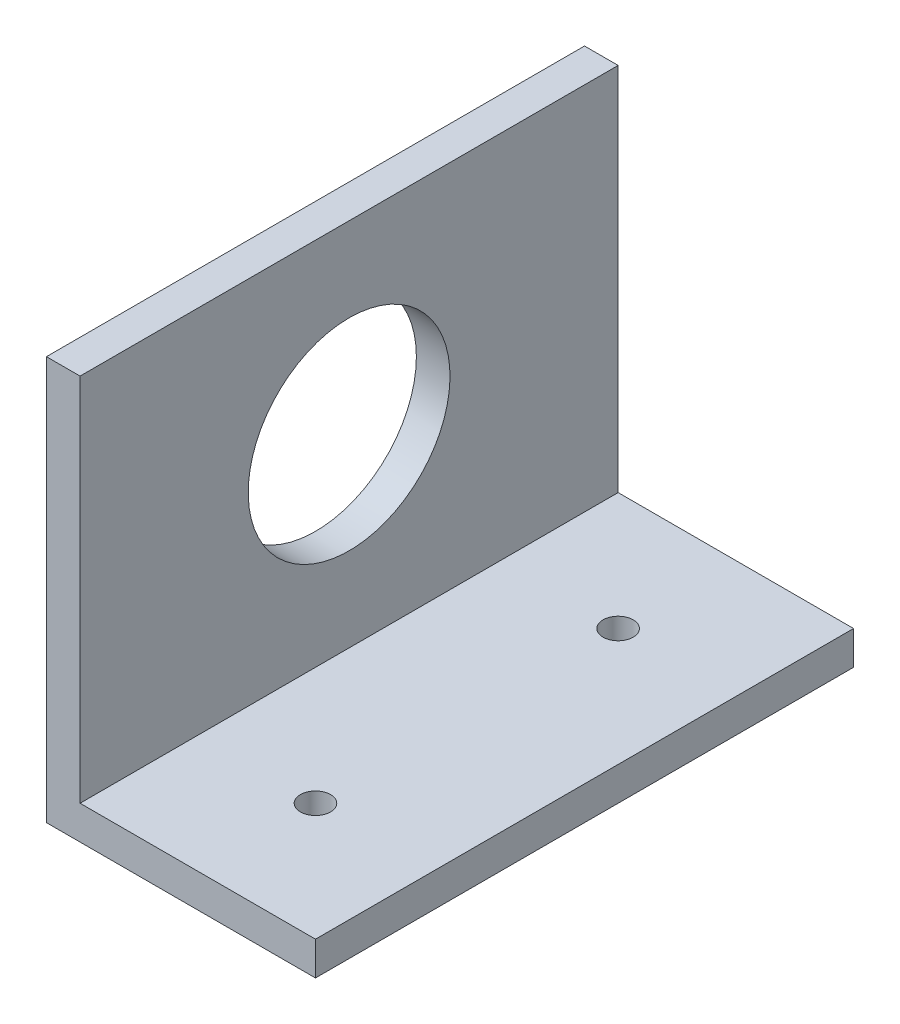
from build123d import *

# Parameters (mm, degrees)
BOSS_EXTRUDE1_DEPTH = 50.8
SKETCH2_R           = 9.525
CUT_EXTRUDE1_DEPTH  = 50.8
SKETCH3_R           = 1.4224
CUT_EXTRUDE2_DEPTH  = 67.675


with BuildPart() as part:
    # Sketch1 → Boss-Extrude1 (new body)
    with BuildSketch(Plane.XY):
        Polygon((25.4, 0), (0, 0), (0, 38.1), (3.175, 38.1), (3.175, 3.175), (25.4, 3.175), align=None)
    extrude(amount=BOSS_EXTRUDE1_DEPTH)

    # Sketch2 → Cut-Extrude1 (cut)
    with BuildSketch(Plane(origin=(3.175, 0, 0), x_dir=(0, 0, -1), z_dir=(1, 0, 0))):
        with Locations(Location((-25.4, 20.6375, 0), (0, 0, 90))):
            Circle(SKETCH2_R)
    extrude(amount=-CUT_EXTRUDE1_DEPTH, mode=Mode.SUBTRACT)

    # Sketch3 → Cut-Extrude2 (cut, through all)
    with BuildSketch(Plane(origin=(0, 3.175, 0), x_dir=(1, 0, 0), z_dir=(0, 1, 0))):
        with Locations(Location((14.2875, -11.1125, 0), (0, 0, 270))):
            Circle(SKETCH3_R)
        with Locations(Location((14.2875, -39.6875, 0), (0, 0, 270))):
            Circle(SKETCH3_R)
    extrude(amount=-CUT_EXTRUDE2_DEPTH, mode=Mode.SUBTRACT)


solid = part.part
